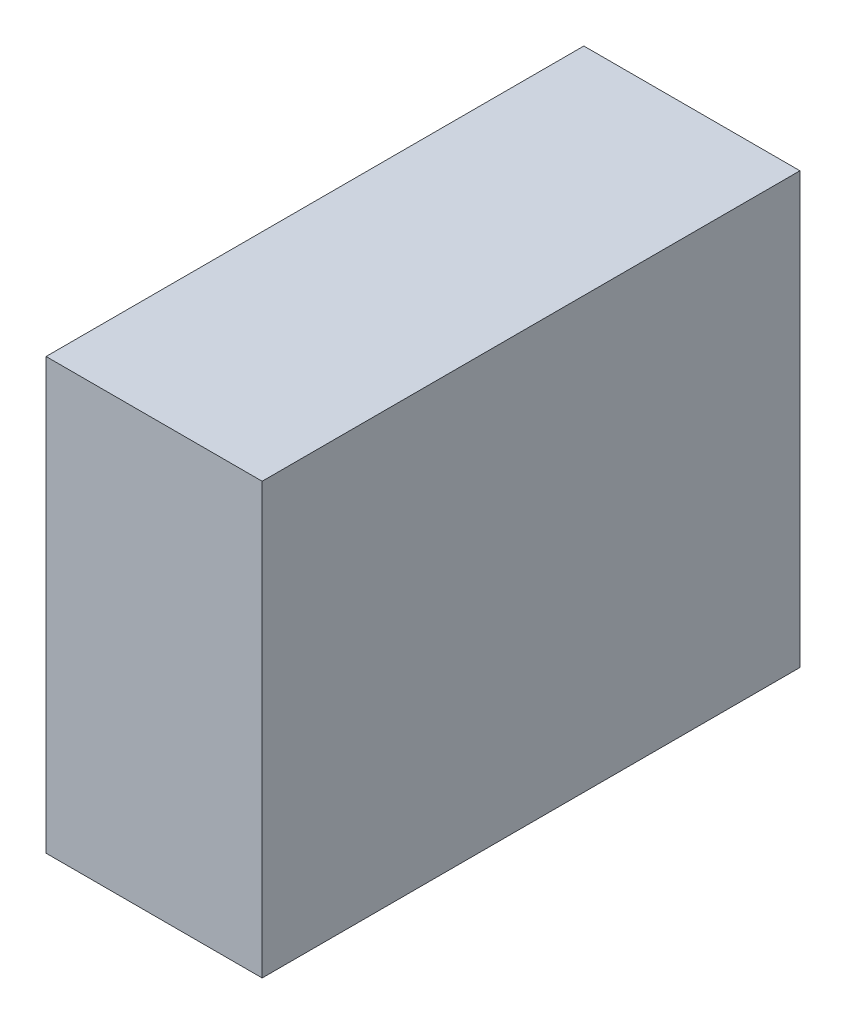
from build123d import *

# Parameters (mm, degrees)
BOSS_EXTRUDE1_DEPTH      = 5
BOSS_EXTRUDE1_DEPTH_BACK = 5


with BuildPart() as part:
    # Sketch1 → Boss-Extrude1 (new, two sides: drawn at the far end of the back side and taken through both)
    with BuildSketch(Plane.XY.offset(-BOSS_EXTRUDE1_DEPTH_BACK)):
        Polygon((0, 0), (2.0456621, 0), (2.0456621, 8), (-1.97260274, 8), (-1.97260274, 0), align=None)
    extrude(amount=BOSS_EXTRUDE1_DEPTH + BOSS_EXTRUDE1_DEPTH_BACK)


solid = part.part
